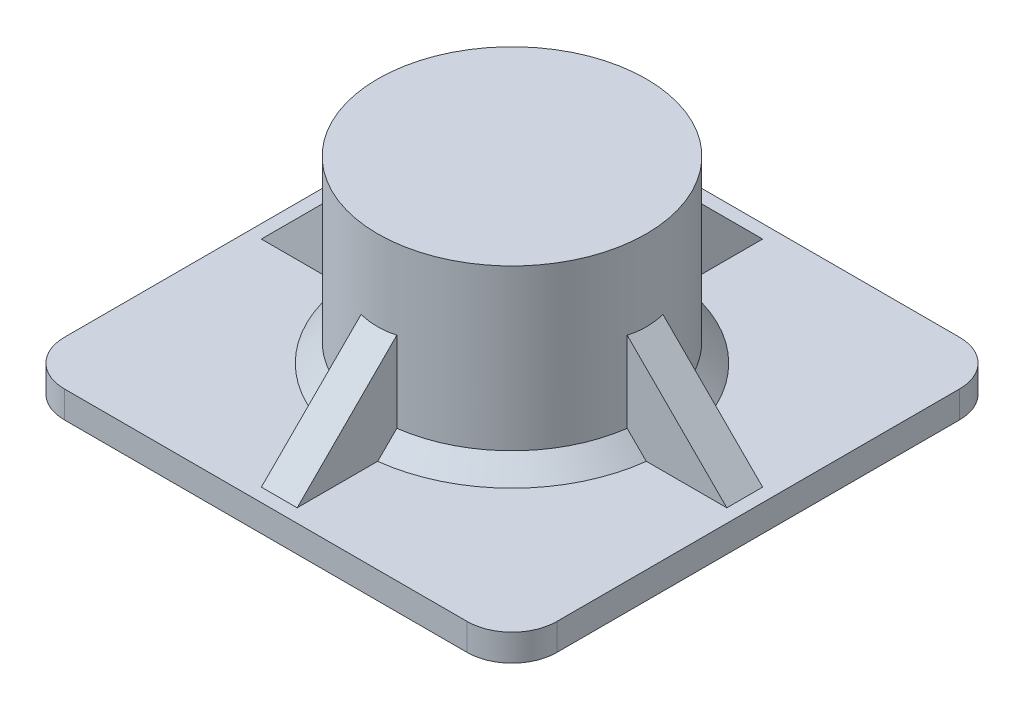
from build123d import *

# Parameters (mm, degrees)
SKETCH1_W           = 55
SKETCH1_H           = 55
BOSS_EXTRUDE1_DEPTH = 3
BOSS_EXTRUDE2_DEPTH = 2
CIRPATTERN1_COUNT   = 4
FILLET1_R           = 5


with BuildPart() as part:
    # Sketch1 → Boss-Extrude1 (new body)
    with BuildSketch(Plane(origin=(0, 0, 0), x_dir=(1, 0, 0), z_dir=(0, 1, 0))):
        Rectangle(SKETCH1_W, SKETCH1_H)
    extrude(amount=BOSS_EXTRUDE1_DEPTH)

    # Sketch2 → Revolve1 (revolve)
    with BuildSketch(Plane.XY):
        Polygon((0, 3), (0, 23), (15, 23), (15, 5.121320344), (17.121320344, 3), align=None)
    revolve(axis=Axis((0, 3, 0), (0, 1, 0)))

    # Sketch3 → Boss-Extrude2 (add, symmetric)
    with BuildSketch(Plane(origin=(0, 0, 0), x_dir=(0, 0, -1), z_dir=(1, 0, 0))):
        Polygon((10, 3), (10, 19), (26, 3), align=None)
    boss_extrude2 = extrude(amount=BOSS_EXTRUDE2_DEPTH, both=True)

    # CirPattern1: Boss-Extrude2 ×4 about axis
    cirpattern1_axis = Axis((0, 0, 0), (0, 1, 0))
    for i in range(1, CIRPATTERN1_COUNT):
        add(boss_extrude2.rotate(cirpattern1_axis, i * 360 / CIRPATTERN1_COUNT))

    # Fillet1
    fillet1_edges = [part.edges().sort_by_distance(p)[0] for p in [
        (-27.5, 1.5, 27.5),
        (-27.5, 1.5, -27.5),
        (27.5, 1.5, -27.5),
        (27.5, 1.5, 27.5),
    ]]
    fillet(fillet1_edges, radius=FILLET1_R)


solid = part.part
